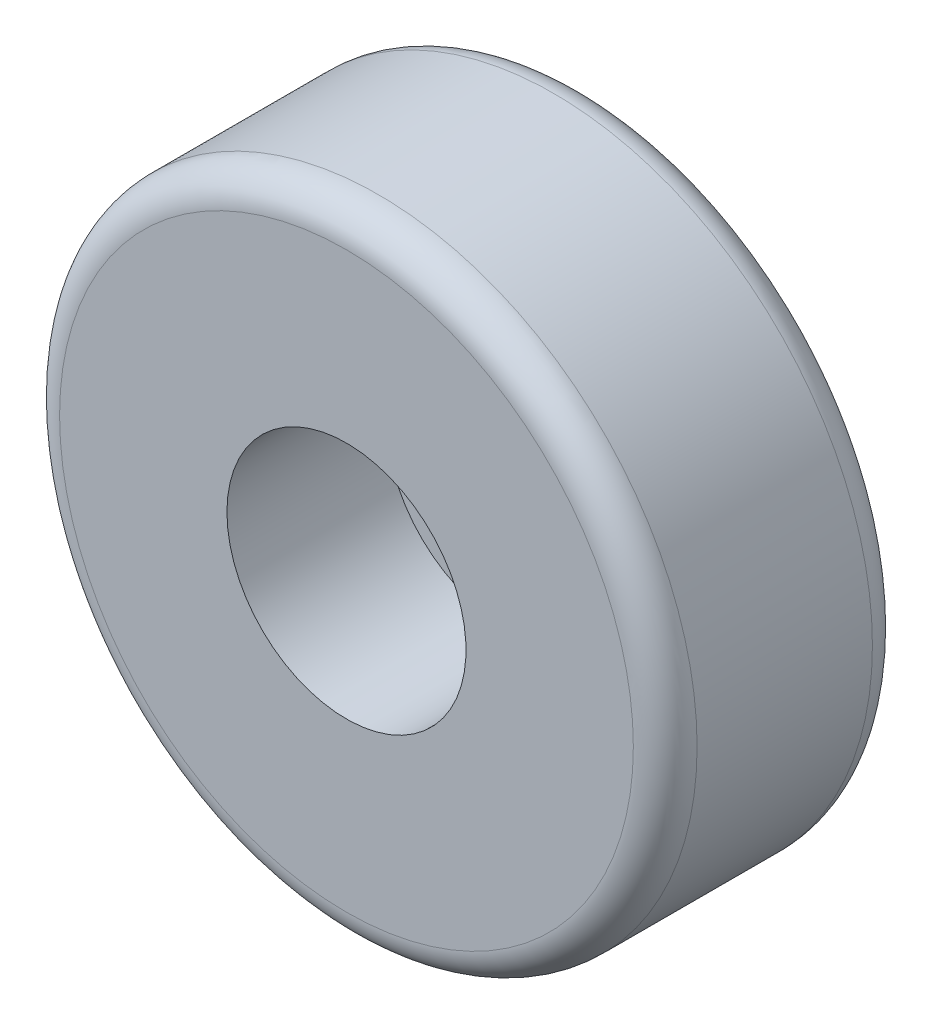
from build123d import *

# Parameters (mm, degrees)
SKETCH1_R           = 101.6
SKETCH1_R_2         = 38.1
BOSS_EXTRUDE7_DEPTH = 76.2
SKETCH1_11_R        = 38.1
BOSS_EXTRUDE9_DEPTH = 25.4
FILLET1_R           = 10.16
SKETCH2_R           = 74.820465974
SKETCH2_R_2         = 38.1
CUT_EXTRUDE1_DEPTH  = 12.7


with BuildPart() as part:
    # Sketch1 → Boss-Extrude7 (new body)
    with BuildSketch(Plane.XY):
        Circle(SKETCH1_R)
        Circle(SKETCH1_R_2, mode=Mode.SUBTRACT)
    extrude(amount=BOSS_EXTRUDE7_DEPTH)

    # Sketch1<11> → Boss-Extrude9 (add)
    with BuildSketch(Plane.XY):
        Circle(SKETCH1_11_R)
    extrude(amount=BOSS_EXTRUDE9_DEPTH)

    # Fillet1
    fillet1_edges = [part.edges().sort_by_distance(p)[0] for p in [
        (-101.6, 0, 76.2),
        (-101.6, 0, 0),
    ]]
    fillet(fillet1_edges, radius=FILLET1_R)

    # Sketch2 → Cut-Extrude1 (cut)
    with BuildSketch(Plane(origin=(0, 0, 0), x_dir=(-1, 0, 0), z_dir=(0, 0, -1))):
        Circle(SKETCH2_R)
        Circle(SKETCH2_R_2, mode=Mode.SUBTRACT)
    extrude(amount=-CUT_EXTRUDE1_DEPTH, mode=Mode.SUBTRACT)


solid = part.part
